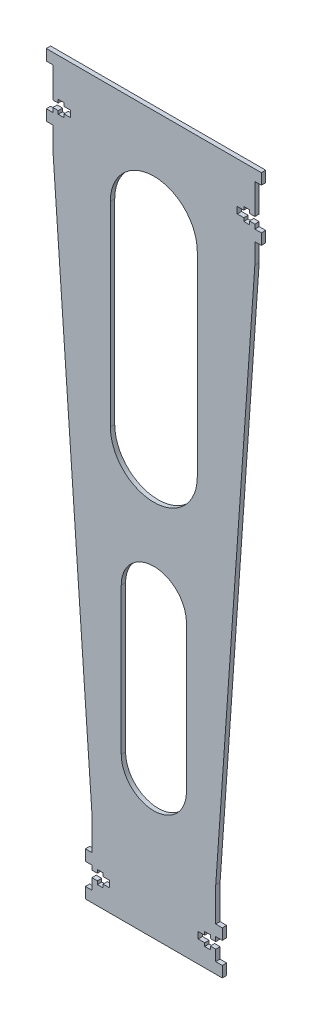
from build123d import *

# Parameters (mm, degrees)
EXTRUDE_1_DEPTH = 2


with BuildPart() as part:
    # 草图1 → 凸台-拉伸1 (new body)
    with BuildSketch(Plane.XY):
        Polygon((26.233844386, -52.574512395), (29.233844386, -52.574512395), (29.233844386, -47.574512395), (26.233844386, -47.574512395), (26.233844386, -31.938300989), (44.233844386, 224.125487605), (44.233844386, 233.475487605), (47.233844386, 233.475487605), (47.233844386, 238.475487605), (44.233844386, 238.475487605), (44.233844386, 240.475487605), (41.733844386, 240.475487605), (41.733844386, 238.975487605), (39.133844386, 238.975487605), (39.133844386, 240.475487605), (36.133844386, 240.475487605), (36.133844386, 243.475487605), (39.133844386, 243.475487605), (39.133844386, 244.975487605), (41.733844386, 244.975487605), (41.733844386, 243.475487605), (44.233844386, 243.475487605), (44.233844386, 248.475487605), (44.233844386, 257.475487605), (47.233844386, 257.475487605), (47.233844386, 262.475487605), (44.233844386, 262.475487605), (-48.766155614, 262.475487605), (-51.766155614, 262.475487605), (-51.766155614, 257.475487605), (-48.766155614, 257.475487605), (-48.766155614, 248.475487605), (-48.766155614, 243.475487605), (-46.266155614, 243.475487605), (-46.266155614, 244.975487605), (-43.666155614, 244.975487605), (-43.666155614, 243.475487605), (-40.666155614, 243.475487605), (-40.666155614, 240.475487605), (-43.666155614, 240.475487605), (-43.666155614, 238.975487605), (-46.266155614, 238.975487605), (-46.266155614, 240.475487605), (-48.766155614, 240.475487605), (-48.766155614, 238.475487605), (-51.766155614, 238.475487605), (-51.766155614, 233.475487605), (-48.766155614, 233.475487605), (-48.766155614, 224.125487605), (-30.766155614, -31.938300989), (-30.766155614, -47.574512395), (-33.766155614, -47.574512395), (-33.766155614, -52.574512395), (-30.766155614, -52.574512395), (-30.766155614, -54.574512395), (-28.266155614, -54.574512395), (-28.266155614, -53.074512395), (-25.666155614, -53.074512395), (-25.666155614, -54.574512395), (-22.666155614, -54.574512395), (-22.666155614, -57.574512395), (-25.666155614, -57.574512395), (-25.666155614, -59.074512395), (-28.266155614, -59.074512395), (-28.266155614, -57.574512395), (-30.766155614, -57.574512395), (-30.766155614, -62.574512395), (-33.766155614, -62.574512395), (-33.766155614, -67.574512395), (-30.766155614, -67.574512395), (26.233844386, -67.574512395), (29.233844386, -67.574512395), (29.233844386, -62.574512395), (26.233844386, -62.574512395), (26.233844386, -57.574512395), (23.733844386, -57.574512395), (23.733844386, -59.074512395), (21.133844386, -59.074512395), (21.133844386, -57.574512395), (18.133844386, -57.574512395), (18.133844386, -54.574512395), (21.133844386, -54.574512395), (21.133844386, -53.074512395), (23.733844386, -53.074512395), (23.733844386, -54.574512395), (26.233844386, -54.574512395), align=None)
        with BuildLine():
            Line((-17.266155614, -1.672218314), (-17.266155614, 65.795616335))
            ThreePointArc((-17.266155614, 65.795616335), (-2.266155614, 80.795616335), (12.733844386, 65.795616335))
            Line((12.733844386, 65.795616335), (12.733844386, -1.672218314))
            ThreePointArc((12.733844386, -1.672218314), (-2.266155614, -16.672218314), (-17.266155614, -1.672218314))
        make_face(mode=Mode.SUBTRACT)
        with BuildLine():
            Line((-22.266155614, 216.327781686), (-22.266155614, 126.327781686))
            ThreePointArc((-22.266155614, 126.327781686), (-2.266155614, 106.327781686), (17.733844386, 126.327781686))
            Line((17.733844386, 126.327781686), (17.733844386, 216.327781686))
            ThreePointArc((17.733844386, 216.327781686), (-2.266155614, 236.327781686), (-22.266155614, 216.327781686))
        make_face(mode=Mode.SUBTRACT)
    extrude(amount=EXTRUDE_1_DEPTH)


solid = part.part
